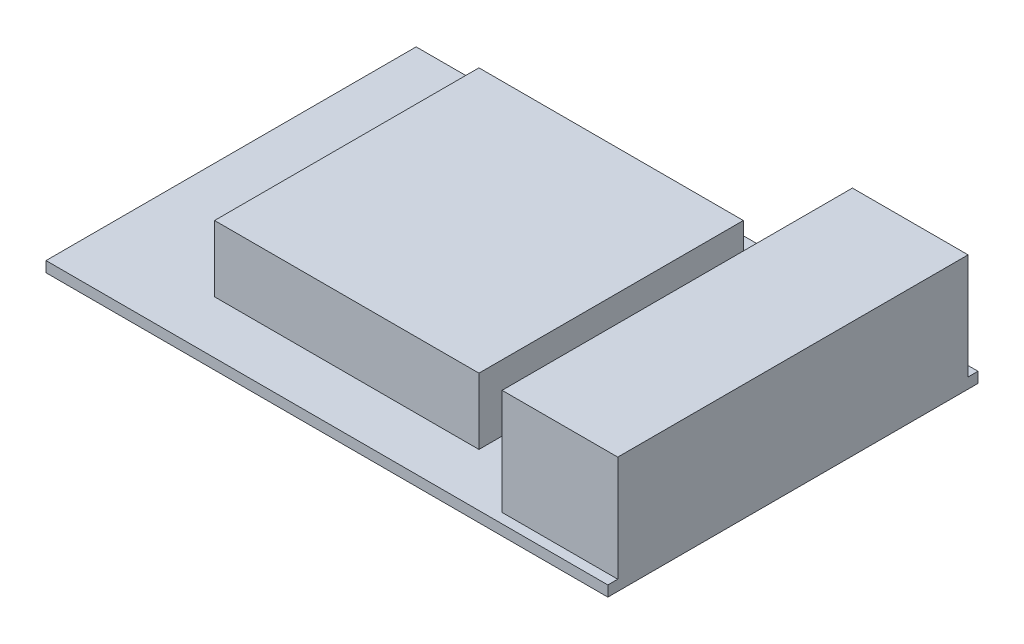
from build123d import *

# Parameters (mm, degrees)
SK_BOARD_W   = 85
SK_BOARD_H   = 1.6
BOARD_DEPTH  = 28
SK_COOLER_W  = 40
SK_COOLER_H  = 10
COOLER_DEPTH = 20
SK_PORTS_W   = 17.5
SK_PORTS_H   = 16
PORTS_DEPTH  = 26.5


with BuildPart() as part:
    # SK_Board → Board (new, symmetric)
    with BuildSketch(Plane.XY):
        with Locations((0, 0.8)):
            Rectangle(SK_BOARD_W, SK_BOARD_H)
    extrude(amount=BOARD_DEPTH, both=True)

    # SK_Cooler → Cooler (add, symmetric)
    with BuildSketch(Plane.XY):
        with Locations((-5, 6.6)):
            Rectangle(SK_COOLER_W, SK_COOLER_H)
    extrude(amount=COOLER_DEPTH, both=True)

    # SK_Ports → Ports (add, symmetric)
    with BuildSketch(Plane.XY):
        with Locations((33.75, 9.6)):
            Rectangle(SK_PORTS_W, SK_PORTS_H)
    extrude(amount=PORTS_DEPTH, both=True)


solid = part.part
